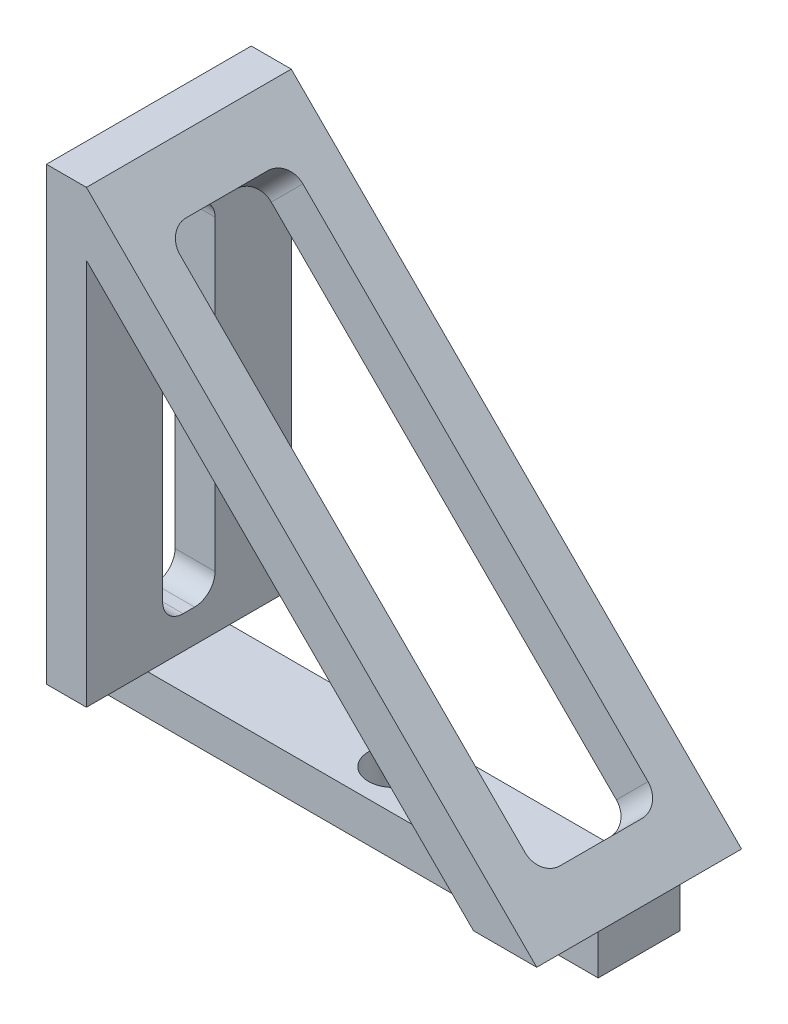
from build123d import *

# Parameters (mm, degrees)
BOSS_EXTRUDE1_DEPTH            = 15.875
CUT_EXTRUDE1_REACH             = 62.253
SKETCH2_W                      = 19.05
SKETCH2_H                      = 82
CUT_EXTRUDE2_REACH             = 101.98
SKETCH3_W                      = 8.128
SKETCH3_H                      = 53.92
CUT_EXTRUDE3_REACH             = 106.403
SKETCH4_W                      = 9.525
SKETCH4_H                      = 6.2
F_5_16_0_3125_DIAMETER_HOLE1_D = 7.9375
FILLET1_R                      = 3.175
FILLET2_R                      = 3.175


with BuildPart() as part:
    # Sketch1 → Boss-Extrude1 (new, symmetric)
    with BuildSketch(Plane.XY):
        Polygon((-6.2, 69.8), (-6.2, -6.2), (69.8, -6.2), (69.8, 0), (0, 69.8), align=None)
        Polygon((0, 60), (60, 0), (0, 0), align=None, mode=Mode.SUBTRACT)
    extrude(amount=BOSS_EXTRUDE1_DEPTH, both=True)

    # Sketch2 → Cut-Extrude1 (cut, up to next)
    with BuildSketch(Plane(origin=(34.9, 34.9, 0), x_dir=(0, 0, -1), z_dir=(0.7071067811865475, 0.7071067811865476, 0)), mode=Mode.PRIVATE) as cut_extrude1_sk1:
        Rectangle(SKETCH2_W, SKETCH2_H)
    cut_extrude1_tool1 = extrude(cut_extrude1_sk1.sketch, amount=-CUT_EXTRUDE1_REACH, mode=Mode.PRIVATE) & part.part
    add(cut_extrude1_tool1.solids().sort_by_distance((34.9, 34.9, 0))[0], mode=Mode.SUBTRACT)

    # Sketch3 → Cut-Extrude2 (cut, up to next)
    with BuildSketch(Plane(origin=(0, 0, 0), x_dir=(0, 0, -1), z_dir=(1, 0, 0)), mode=Mode.PRIVATE) as cut_extrude2_sk1:
        with Locations((0, 32.04)):
            Rectangle(SKETCH3_W, SKETCH3_H)
    cut_extrude2_tool1 = extrude(cut_extrude2_sk1.sketch, amount=-CUT_EXTRUDE2_REACH, mode=Mode.PRIVATE) & part.part
    add(cut_extrude2_tool1.solids().sort_by_distance((0, 32.04, 0))[0], mode=Mode.SUBTRACT)

    # Sketch4 → Cut-Extrude3 (cut, up to next)
    with BuildSketch(Plane(origin=(69.8, 0, 0), x_dir=(0, 0, -1), z_dir=(1, 0, 0)), mode=Mode.PRIVATE) as cut_extrude3_sk1:
        with Locations((-11.1125, -3.1)):
            Rectangle(SKETCH4_W, SKETCH4_H)
    cut_extrude3_tool1 = extrude(cut_extrude3_sk1.sketch, amount=-CUT_EXTRUDE3_REACH, mode=Mode.PRIVATE) & part.part
    # Sketch4 → Cut-Extrude3 (cut, up to next)
    with BuildSketch(Plane(origin=(69.8, 0, 0), x_dir=(0, 0, -1), z_dir=(1, 0, 0)), mode=Mode.PRIVATE) as cut_extrude3_sk2:
        with Locations((11.1125, -3.1)):
            Rectangle(SKETCH4_W, SKETCH4_H)
    cut_extrude3_tool2 = extrude(cut_extrude3_sk2.sketch, amount=-CUT_EXTRUDE3_REACH, mode=Mode.PRIVATE) & part.part
    add(cut_extrude3_tool1.solids().sort_by_distance((69.8, -3.1, 11.1125))[0], mode=Mode.SUBTRACT)
    add(cut_extrude3_tool2.solids().sort_by_distance((69.8, -3.1, -11.1125))[0], mode=Mode.SUBTRACT)

    # 5/16 (0.3125) Diameter Hole1 (through all)
    with Locations(Plane(origin=(0, -6.2, 0), x_dir=(-1, 0, 0), z_dir=(0, -1, 0))):
        with Locations((-31.8, 0)):
            Hole(F_5_16_0_3125_DIAMETER_HOLE1_D / 2)

    # Fillet1
    fillet1_edges = [part.edges().sort_by_distance(p)[0] for p in [
        (3.458621971, 61.441378029, 9.525),
        (61.441378029, 3.458621971, 9.525),
        (61.441378029, 3.458621971, -9.525),
        (3.458621971, 61.441378029, -9.525),
    ]]
    fillet(fillet1_edges, radius=FILLET1_R)

    # Fillet2
    fillet2_edges = [part.edges().sort_by_distance(p)[0] for p in [
        (-3.1, 59, -4.064),
        (-3.1, 5.08, -4.064),
        (-3.1, 5.08, 4.064),
        (-3.1, 59, 4.064),
    ]]
    fillet(fillet2_edges, radius=FILLET2_R)


solid = part.part
